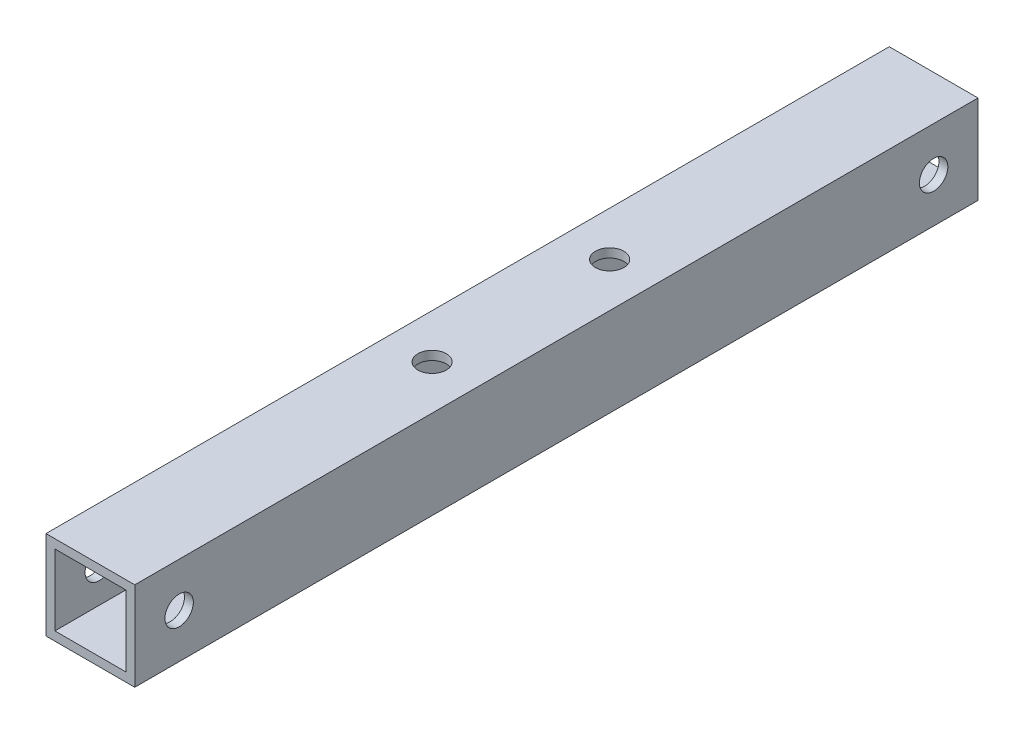
from build123d import *

# Parameters (mm, degrees)
SKETCH_1_W          = 10
SKETCH_1_H          = 10
SKETCH_1_W_2        = 8
SKETCH_1_H_2        = 8
EXTRUDE_1_DEPTH     = 95
SKETCH_3_R          = 1.6
CUT_EXTRUDE_2_DEPTH = 96.655632349
SKETCH_4_R          = 1.6
CUT_EXTRUDE_3_DEPTH = 96.655632349


with BuildPart() as part:
    # ｽｹｯﾁ1 → 押し出し-薄板1 (new body)
    with BuildSketch(Plane.XY):
        Rectangle(SKETCH_1_W, SKETCH_1_H)
        Rectangle(SKETCH_1_W_2, SKETCH_1_H_2, mode=Mode.SUBTRACT)
    extrude(amount=EXTRUDE_1_DEPTH)

    # ｽｹｯﾁ3 → ｶｯﾄ - 押し出し2 (cut, through all)
    with BuildSketch(Plane(origin=(0, 5, 0), x_dir=(1, 0, 0), z_dir=(0, 1, 0))):
        with Locations(Location((0, -56.5, 0), (0, 0, 180))):
            Circle(SKETCH_3_R)
        with Locations(Location((0, -36.5, 0), (0, 0, 180))):
            Circle(SKETCH_3_R)
    extrude(amount=-CUT_EXTRUDE_2_DEPTH, mode=Mode.SUBTRACT)

    # ｽｹｯﾁ4 → ｶｯﾄ - 押し出し3 (cut, through all)
    with BuildSketch(Plane(origin=(5, 0, 0), x_dir=(0, 0, -1), z_dir=(1, 0, 0))):
        with Locations(Location((-90, 0, 0), (0, 0, 90))):
            Circle(SKETCH_4_R)
        with Locations(Location((-5, 0, 0), (0, 0, 270))):
            Circle(SKETCH_4_R)
    extrude(amount=-CUT_EXTRUDE_3_DEPTH, mode=Mode.SUBTRACT)


solid = part.part
